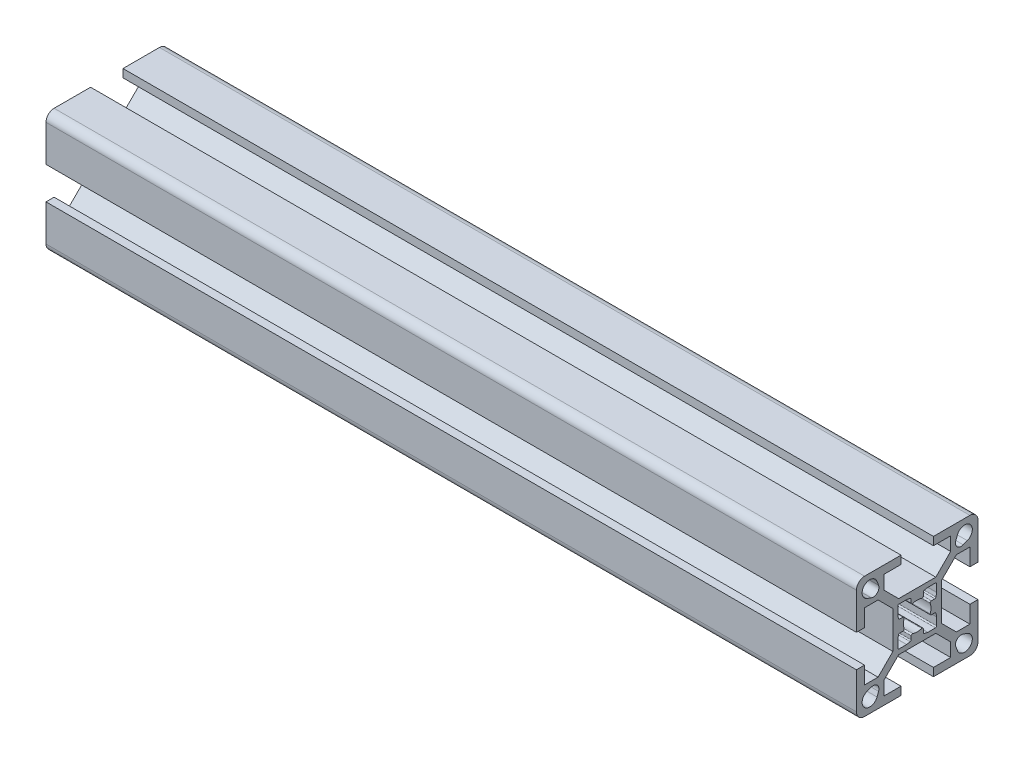
from build123d import *

# Parameters (mm, degrees)
BOSS_EXTRUDE1_DEPTH = 200


with BuildPart() as part:
    # Sketch1 → Boss-Extrude1 (new body)
    with BuildSketch(Plane(origin=(0, 0, 0), x_dir=(0, 0, -1), z_dir=(1, 0, 0))):
        with BuildLine():
            Line((-15, 13), (-15, 4))
            Line((-15, 4), (-13, 4))
            Line((-13, 4), (-13, 8.25))
            Line((-13, 8.25), (-9.664213562, 8.25))
            Line((-9.664213562, 8.25), (-6, 4.585786438))
            Line((-6, 4.585786438), (-6, -4.585786438))
            Line((-6, -4.585786438), (-9.664213562, -8.25))
            Line((-9.664213562, -8.25), (-13, -8.25))
            Line((-13, -8.25), (-13, -4))
            Line((-13, -4), (-15, -4))
            Line((-15, -4), (-15, -13))
            ThreePointArc((-15, -13), (-14.414213562, -14.414213562), (-13, -15))
            Line((-13, -15), (-4, -15))
            Line((-4, -15), (-4, -13))
            Line((-4, -13), (-8.25, -13))
            Line((-8.25, -13), (-8.25, -9.664213562))
            Line((-8.25, -9.664213562), (-4.585786438, -6))
            Line((-4.585786438, -6), (4.585786438, -6))
            Line((4.585786438, -6), (8.25, -9.664213562))
            Line((8.25, -9.664213562), (8.25, -13))
            Line((8.25, -13), (4, -13))
            Line((4, -13), (4, -15))
            Line((4, -15), (13, -15))
            ThreePointArc((13, -15), (14.414213562, -14.414213562), (15, -13))
            Line((15, -13), (15, -4))
            Line((15, -4), (13, -4))
            Line((13, -4), (13, -8.25))
            Line((13, -8.25), (9.664213562, -8.25))
            Line((9.664213562, -8.25), (6, -4.585786438))
            Line((6, -4.585786438), (6, 4.585786438))
            Line((6, 4.585786438), (9.664213562, 8.25))
            Line((9.664213562, 8.25), (13, 8.25))
            Line((13, 8.25), (13, 4))
            Line((13, 4), (15, 4))
            Line((15, 4), (15, 13))
            ThreePointArc((15, 13), (14.414213562, 14.414213562), (13, 15))
            Line((13, 15), (4, 15))
            Line((4, 15), (4, 13))
            Line((4, 13), (8.25, 13))
            Line((8.25, 13), (8.25, 9.664213562))
            Line((8.25, 9.664213562), (4.585786438, 6))
            Line((4.585786438, 6), (-4.585786438, 6))
            Line((-4.585786438, 6), (-8.25, 9.664213562))
            Line((-8.25, 9.664213562), (-8.25, 13))
            Line((-8.25, 13), (-4, 13))
            Line((-4, 13), (-4, 15))
            Line((-4, 15), (-13, 15))
            ThreePointArc((-13, 15), (-14.414213562, 14.414213562), (-15, 13))
        make_face()
        with BuildLine():
            Line((-9.539070071, 11.338915743), (-9.918883282, 12.361530981))
            ThreePointArc((-9.918883282, 12.361530981), (-13.043502884, 13.043502884), (-12.361530981, 9.918883282))
            Line((-12.361530981, 9.918883282), (-11.338915743, 9.539070071))
            ThreePointArc((-11.338915743, 9.539070071), (-9.861522369, 9.861522369), (-9.539070071, 11.338915743))
        make_face(mode=Mode.SUBTRACT)
        with BuildLine():
            Line((9.918883282, 12.361530981), (9.539070071, 11.338915743))
            ThreePointArc((9.539070071, 11.338915743), (9.861522369, 9.861522369), (11.338915743, 9.539070071))
            Line((11.338915743, 9.539070071), (12.361530981, 9.918883282))
            ThreePointArc((12.361530981, 9.918883282), (13.043502884, 13.043502884), (9.918883282, 12.361530981))
        make_face(mode=Mode.SUBTRACT)
        with BuildLine():
            Line((12.361530981, -9.918883282), (11.338915743, -9.539070071))
            ThreePointArc((11.338915743, -9.539070071), (9.861522369, -9.861522369), (9.539070071, -11.338915743))
            Line((9.539070071, -11.338915743), (9.918883282, -12.361530981))
            ThreePointArc((9.918883282, -12.361530981), (13.043502884, -13.043502884), (12.361530981, -9.918883282))
        make_face(mode=Mode.SUBTRACT)
        with BuildLine():
            Line((-11.338915743, -9.539070071), (-12.361530981, -9.918883282))
            ThreePointArc((-12.361530981, -9.918883282), (-13.043502884, -13.043502884), (-9.918883282, -12.361530981))
            Line((-9.918883282, -12.361530981), (-9.539070071, -11.338915743))
            ThreePointArc((-9.539070071, -11.338915743), (-9.861522369, -9.861522369), (-11.338915743, -9.539070071))
        make_face(mode=Mode.SUBTRACT)
        with BuildLine():
            Line((-4.8, -2.644433572), (-4.8, -4.5))
            ThreePointArc((-4.8, -4.5), (-4.712132034, -4.712132034), (-4.5, -4.8))
            Line((-4.5, -4.8), (-2.644433572, -4.8))
            ThreePointArc((-2.644433572, -4.8), (-2.615679847, -4.79861886), (-2.587190874, -4.794488155))
            Line((-2.587190874, -4.794488155), (-1.742757301, -4.630346896))
            ThreePointArc((-1.742757301, -4.630346896), (-1.568512625, -4.526682207), (-1.5, -4.335858741))
            Line((-1.5, -4.335858741), (-1.5, -3.5))
            ThreePointArc((-1.5, -3.5), (-1.374371458, -3.255879959), (-1.102702703, -3.216216216))
            ThreePointArc((-1.102702703, -3.216216216), (0, -3.4), (1.102702703, -3.216216216))
            ThreePointArc((1.102702703, -3.216216216), (1.374371458, -3.255879959), (1.5, -3.5))
            Line((1.5, -3.5), (1.5, -4.335858741))
            ThreePointArc((1.5, -4.335858741), (1.568512625, -4.526682207), (1.742757301, -4.630346896))
            Line((1.742757301, -4.630346896), (2.587190874, -4.794488155))
            ThreePointArc((2.587190874, -4.794488155), (2.615679847, -4.79861886), (2.644433572, -4.8))
            Line((2.644433572, -4.8), (4.5, -4.8))
            ThreePointArc((4.5, -4.8), (4.712132034, -4.712132034), (4.8, -4.5))
            Line((4.8, -4.5), (4.8, -2.644433572))
            ThreePointArc((4.8, -2.644433572), (4.79861886, -2.615679847), (4.794488155, -2.587190874))
            Line((4.794488155, -2.587190874), (4.630346896, -1.742757301))
            ThreePointArc((4.630346896, -1.742757301), (4.526682207, -1.568512625), (4.335858741, -1.5))
            Line((4.335858741, -1.5), (3.5, -1.5))
            ThreePointArc((3.5, -1.5), (3.255879959, -1.374371458), (3.216216216, -1.102702703))
            ThreePointArc((3.216216216, -1.102702703), (3.4, 0), (3.216216216, 1.102702703))
            ThreePointArc((3.216216216, 1.102702703), (3.255879959, 1.374371458), (3.5, 1.5))
            Line((3.5, 1.5), (4.335858741, 1.5))
            ThreePointArc((4.335858741, 1.5), (4.526682207, 1.568512625), (4.630346896, 1.742757301))
            Line((4.630346896, 1.742757301), (4.794488155, 2.587190874))
            ThreePointArc((4.794488155, 2.587190874), (4.79861886, 2.615679847), (4.8, 2.644433572))
            Line((4.8, 2.644433572), (4.8, 4.5))
            ThreePointArc((4.8, 4.5), (4.712132034, 4.712132034), (4.5, 4.8))
            Line((4.5, 4.8), (2.644433572, 4.8))
            ThreePointArc((2.644433572, 4.8), (2.615679847, 4.79861886), (2.587190874, 4.794488155))
            Line((2.587190874, 4.794488155), (1.742757301, 4.630346896))
            ThreePointArc((1.742757301, 4.630346896), (1.568512625, 4.526682207), (1.5, 4.335858741))
            Line((1.5, 4.335858741), (1.5, 3.5))
            ThreePointArc((1.5, 3.5), (1.374371458, 3.255879959), (1.102702703, 3.216216216))
            ThreePointArc((1.102702703, 3.216216216), (0, 3.4), (-1.102702703, 3.216216216))
            ThreePointArc((-1.102702703, 3.216216216), (-1.374371458, 3.255879959), (-1.5, 3.5))
            Line((-1.5, 3.5), (-1.5, 4.335858741))
            ThreePointArc((-1.5, 4.335858741), (-1.568512625, 4.526682207), (-1.742757301, 4.630346896))
            Line((-1.742757301, 4.630346896), (-2.587190874, 4.794488155))
            ThreePointArc((-2.587190874, 4.794488155), (-2.615679847, 4.79861886), (-2.644433572, 4.8))
            Line((-2.644433572, 4.8), (-4.5, 4.8))
            ThreePointArc((-4.5, 4.8), (-4.712132034, 4.712132034), (-4.8, 4.5))
            Line((-4.8, 4.5), (-4.8, 2.644433572))
            ThreePointArc((-4.8, 2.644433572), (-4.79861886, 2.615679847), (-4.794488155, 2.587190874))
            Line((-4.794488155, 2.587190874), (-4.630346896, 1.742757301))
            ThreePointArc((-4.630346896, 1.742757301), (-4.526682207, 1.568512625), (-4.335858741, 1.5))
            Line((-4.335858741, 1.5), (-3.5, 1.5))
            ThreePointArc((-3.5, 1.5), (-3.255879959, 1.374371458), (-3.216216216, 1.102702703))
            ThreePointArc((-3.216216216, 1.102702703), (-3.4, 0), (-3.216216216, -1.102702703))
            ThreePointArc((-3.216216216, -1.102702703), (-3.255879959, -1.374371458), (-3.5, -1.5))
            Line((-3.5, -1.5), (-4.335858741, -1.5))
            ThreePointArc((-4.335858741, -1.5), (-4.526682207, -1.568512625), (-4.630346896, -1.742757301))
            Line((-4.630346896, -1.742757301), (-4.794488155, -2.587190874))
            ThreePointArc((-4.794488155, -2.587190874), (-4.79861886, -2.615679847), (-4.8, -2.644433572))
        make_face(mode=Mode.SUBTRACT)
    extrude(amount=BOSS_EXTRUDE1_DEPTH)


solid = part.part
